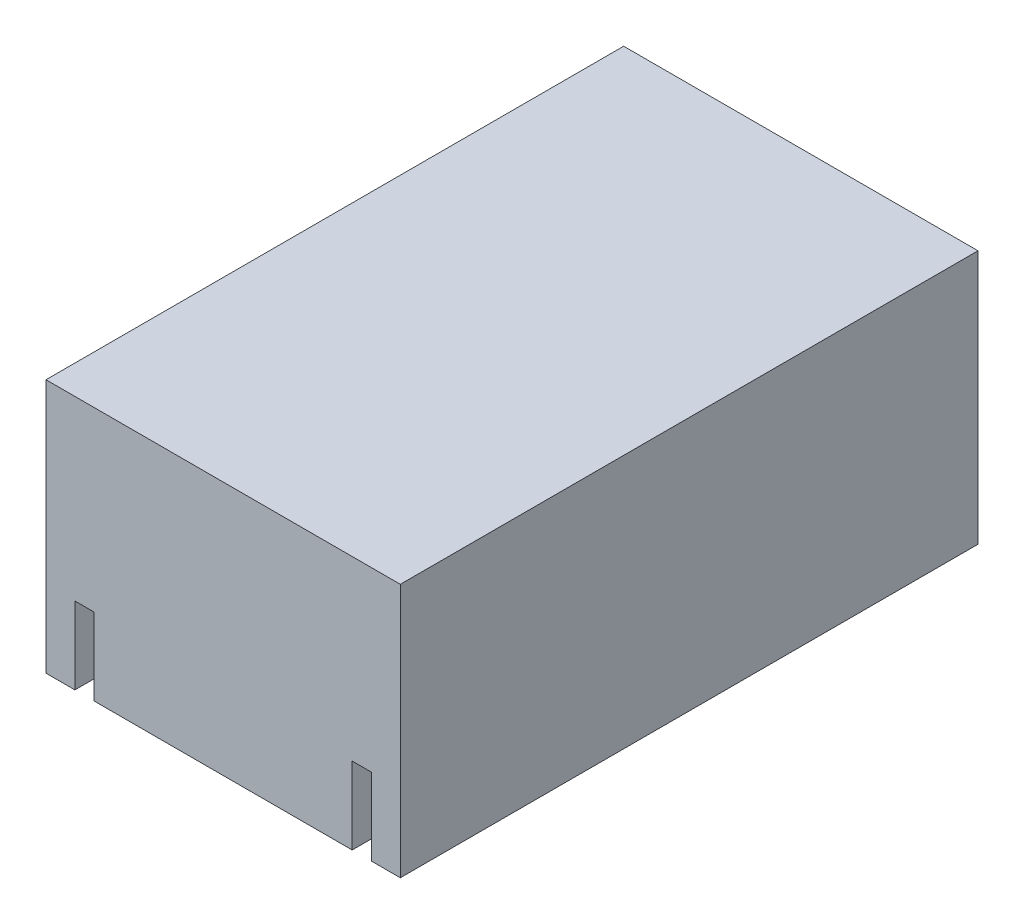
from build123d import *

# Parameters (mm, degrees)
SKIZZE1_W                       = 46
SKIZZE1_H                       = 33
AUFSATZ_LINEAR_AUSTRAGEN1_DEPTH = 75
SKIZZE2_W                       = 2.5
SKIZZE2_H                       = 10
SCHNITT_LINEAR_AUSTRAGEN1_DEPTH = 81.163894616


with BuildPart() as part:
    # Skizze1 → Aufsatz-Linear austragen1 (new body)
    with BuildSketch(Plane.XY):
        Rectangle(SKIZZE1_W, SKIZZE1_H)
    extrude(amount=AUFSATZ_LINEAR_AUSTRAGEN1_DEPTH)

    # Skizze2 → Schnitt-Linear austragen1 (cut, through all)
    with BuildSketch(Plane.XY.offset(75)):
        with Locations((-18, -11.5)):
            Rectangle(SKIZZE2_W, SKIZZE2_H)
        with Locations((18, -11.5)):
            Rectangle(SKIZZE2_W, SKIZZE2_H)
    extrude(amount=-SCHNITT_LINEAR_AUSTRAGEN1_DEPTH, mode=Mode.SUBTRACT)


solid = part.part
